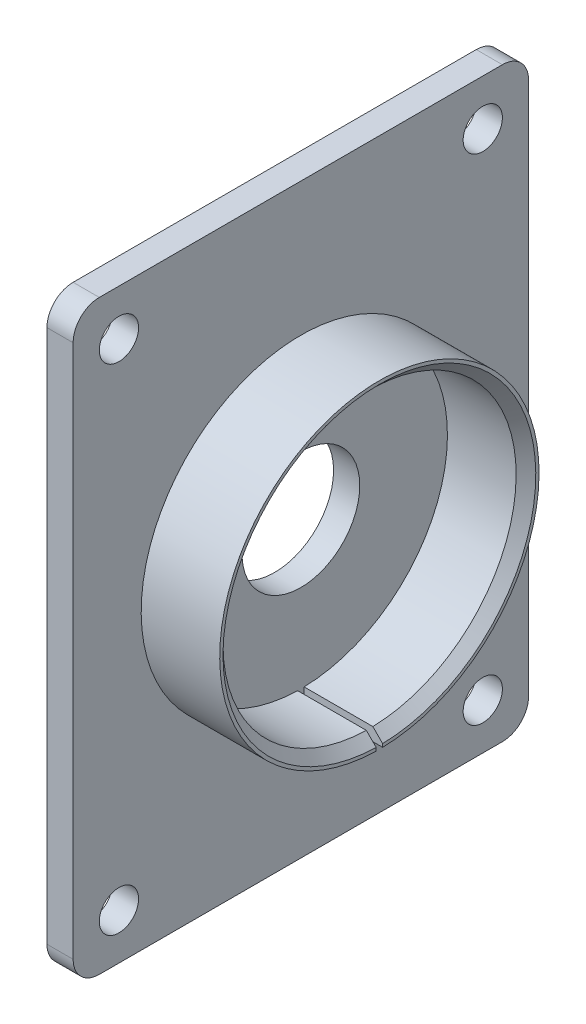
from build123d import *

# Parameters (mm, degrees)
BOSS_EXTRUDE1_DEPTH = 6
SKETCH4_W           = 44.8
SKETCH4_H           = 34.8
SKETCH4_R           = 1.5
BOSS_EXTRUDE3_DEPTH = 2
FILLET1_R           = 2
CHAMFER1_SIZE       = 0.75
SKETCH5_R           = 4.5
CUT_EXTRUDE1_DEPTH  = 29.991722957


with BuildPart() as part:
    # Sketch1 → Boss-Extrude1 (new body)
    with BuildSketch(Plane.YZ):
        with BuildLine():
            Line((-12.197438256, -0.25), (-11.197209474, -0.25))
            ThreePointArc((-11.197209474, -0.25), (11.2, 0), (-11.197209474, 0.25))
            Line((-11.197209474, 0.25), (-12.197438256, 0.25))
            ThreePointArc((-12.197438256, 0.25), (12.2, 0), (-12.197438256, -0.25))
        make_face()
    extrude(amount=BOSS_EXTRUDE1_DEPTH)

    # Sketch4 → Boss-Extrude3 (add)
    with BuildSketch(Plane(origin=(0, 0, 0), x_dir=(0, -1, 0), z_dir=(-1, 0, 0))):
        Rectangle(SKETCH4_W, SKETCH4_H)
        with Locations(Location((-18.9, 13.9, 0), (0, 0, 90))):
            Circle(SKETCH4_R, mode=Mode.SUBTRACT)
        with Locations(Location((18.9, 13.9, 0), (0, 0, 90))):
            Circle(SKETCH4_R, mode=Mode.SUBTRACT)
        with Locations(Location((-18.9, -13.9, 0), (0, 0, 90))):
            Circle(SKETCH4_R, mode=Mode.SUBTRACT)
        with Locations(Location((18.9, -13.9, 0), (0, 0, 90))):
            Circle(SKETCH4_R, mode=Mode.SUBTRACT)
    extrude(amount=BOSS_EXTRUDE3_DEPTH)

    # Fillet1
    fillet1_edges = [part.edges().sort_by_distance(p)[0] for p in [
        (-1, -22.4, 17.4),
        (-1, 22.4, 17.4),
        (-1, 22.4, -17.4),
        (-1, -22.4, -17.4),
    ]]
    fillet(fillet1_edges, radius=FILLET1_R)

    # Chamfer1
    chamfer1_edges = [part.edges().sort_by_distance(p)[0] for p in [
        (6, 11.2, 0),
    ]]
    chamfer(chamfer1_edges, length=CHAMFER1_SIZE)

    # Sketch5 → Cut-Extrude1 (cut, through all)
    with BuildSketch(Plane.YZ):
        with Locations(Location((0, 0, 0), (0, 0, 270))):
            Circle(SKETCH5_R)
    extrude(amount=-CUT_EXTRUDE1_DEPTH, mode=Mode.SUBTRACT)


solid = part.part
